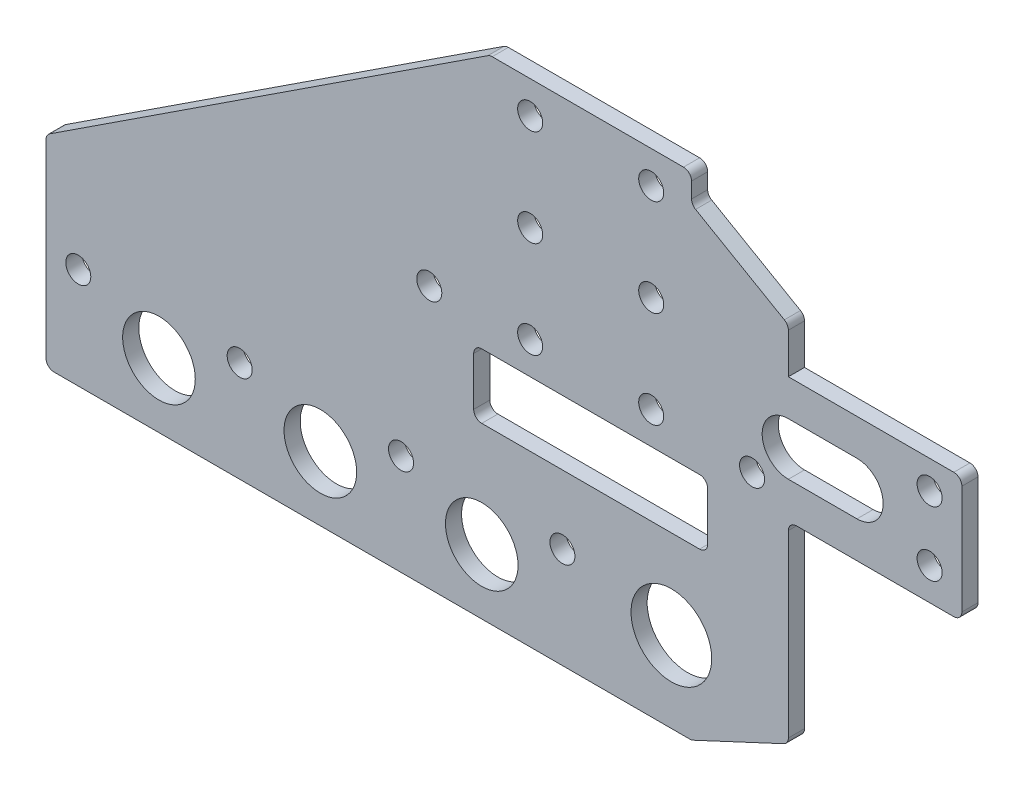
from build123d import *

# Parameters (mm, degrees)
SKETCH_1_R      = 1.55
SKETCH_1_R_2    = 4.5
SKETCH_1_R_3    = 5
SKETCH_1_W      = 29
SKETCH_1_H      = 8
EXTRUDE_1_DEPTH = 2
FILLET_1_R      = 1


with BuildPart() as part:
    # 草图1 → 凸台-拉伸1 (new body)
    with BuildSketch(Plane.XY):
        Polygon((0, 0), (-80, 0), (-80, 25), (-25, 61), (0, 61), (0, 57.5), (12, 50.57179677), (12, 45), (33.5, 45), (33.5, 29.5), (12, 29.5), (12, 5.595691898), align=None)
        with Locations((-36, 12.5)):
            Circle(SKETCH_1_R, mode=Mode.SUBTRACT)
        with Locations((-56, 12.5)):
            Circle(SKETCH_1_R, mode=Mode.SUBTRACT)
        with Locations((-76, 12.5)):
            Circle(SKETCH_1_R, mode=Mode.SUBTRACT)
        with Locations((-16, 12.5)):
            Circle(SKETCH_1_R, mode=Mode.SUBTRACT)
        with Locations((29.5, 41.5)):
            Circle(SKETCH_1_R, mode=Mode.SUBTRACT)
        with Locations((29.5, 33.5)):
            Circle(SKETCH_1_R, mode=Mode.SUBTRACT)
        with Locations((-5, 33)):
            Circle(SKETCH_1_R, mode=Mode.SUBTRACT)
        with Locations((-20, 33)):
            Circle(SKETCH_1_R, mode=Mode.SUBTRACT)
        with Locations((-5, 45)):
            Circle(SKETCH_1_R, mode=Mode.SUBTRACT)
        with Locations((-20, 45)):
            Circle(SKETCH_1_R, mode=Mode.SUBTRACT)
        with Locations((-5, 57)):
            Circle(SKETCH_1_R, mode=Mode.SUBTRACT)
        with Locations((-20, 57)):
            Circle(SKETCH_1_R, mode=Mode.SUBTRACT)
        with Locations((-26, 8)):
            Circle(SKETCH_1_R_2, mode=Mode.SUBTRACT)
        with Locations((-46, 8)):
            Circle(SKETCH_1_R_2, mode=Mode.SUBTRACT)
        with Locations((-66, 8)):
            Circle(SKETCH_1_R_2, mode=Mode.SUBTRACT)
        with Locations((-2.5, 10)):
            Circle(SKETCH_1_R_3, mode=Mode.SUBTRACT)
        with Locations((-32.5, 32.5)):
            Circle(SKETCH_1_R, mode=Mode.SUBTRACT)
        with Locations(Location((7.5, 32.5, 0), (0, 0, 180))):
            Circle(SKETCH_1_R, mode=Mode.SUBTRACT)
        with Locations((-12.5, 25)):
            Rectangle(SKETCH_1_W, SKETCH_1_H, mode=Mode.SUBTRACT)
        with BuildLine():
            Line((20.5, 34), (12, 34))
            ThreePointArc((12, 34), (8.75, 37.25), (12, 40.5))
            Line((12, 40.5), (20.5, 40.5))
            ThreePointArc((20.5, 40.5), (23.75, 37.25), (20.5, 34))
        make_face(mode=Mode.SUBTRACT)
    extrude(amount=EXTRUDE_1_DEPTH)

    # 圆角1
    fillet_1_edges = [part.edges().sort_by_distance(p)[0] for p in [
        (0, 0, 1),
        (-80, 0, 1),
        (-80, 25, 1),
        (-25, 61, 1),
        (0, 61, 1),
        (0, 57.5, 1),
        (12, 50.57179677, 1),
        (33.5, 45, 1),
        (33.5, 29.5, 1),
        (12, 29.5, 1),
        (12, 5.595691898, 1),
        (-27, 29, 1),
        (-27, 21, 1),
        (2, 21, 1),
        (2, 29, 1),
    ]]
    fillet(fillet_1_edges, radius=FILLET_1_R)


solid = part.part
